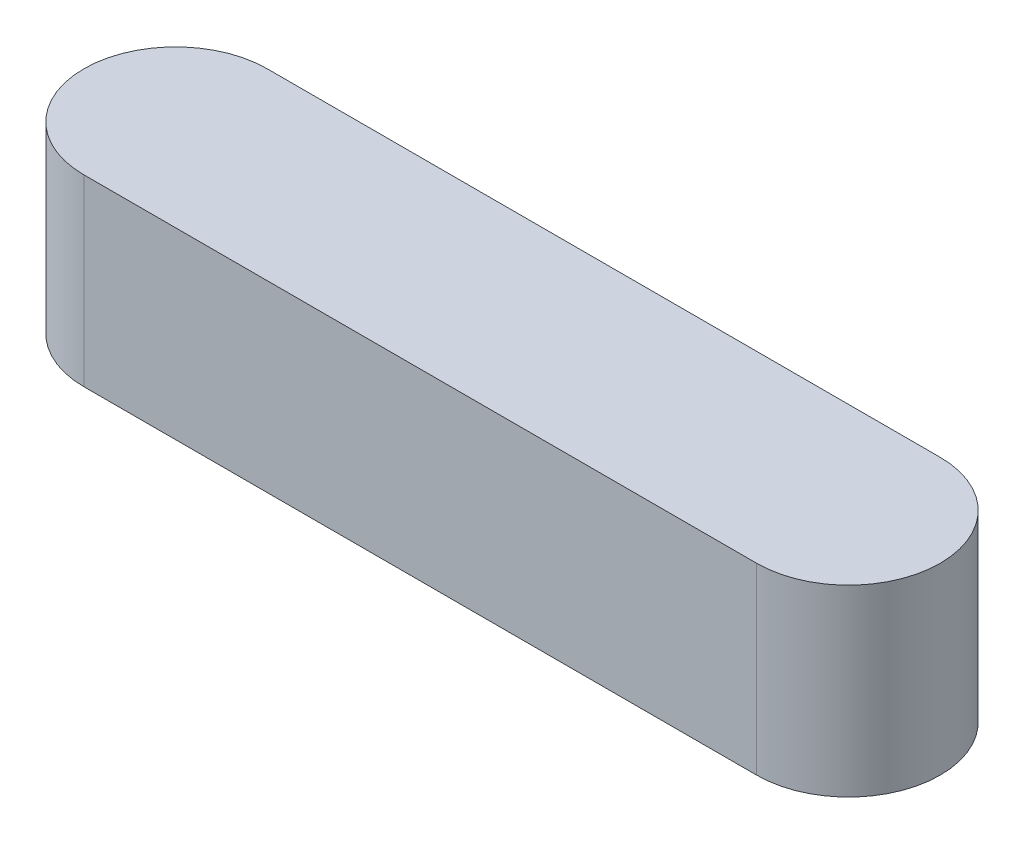
from build123d import *

# Parameters (mm, degrees)
EXTRUDE_1_DEPTH = 3


with BuildPart() as part:
    # 草图1 → 凸台-拉伸1 (new body)
    with BuildSketch(Plane(origin=(0, 0, 0), x_dir=(1, 0, 0), z_dir=(0, 1, 0))):
        with BuildLine():
            Line((0, 1.5), (11, 1.5))
            ThreePointArc((11, 1.5), (12.5, 0), (11, -1.5))
            Line((11, -1.5), (0, -1.5))
            ThreePointArc((0, -1.5), (-1.5, 0), (0, 1.5))
        make_face()
    extrude(amount=EXTRUDE_1_DEPTH)


solid = part.part
